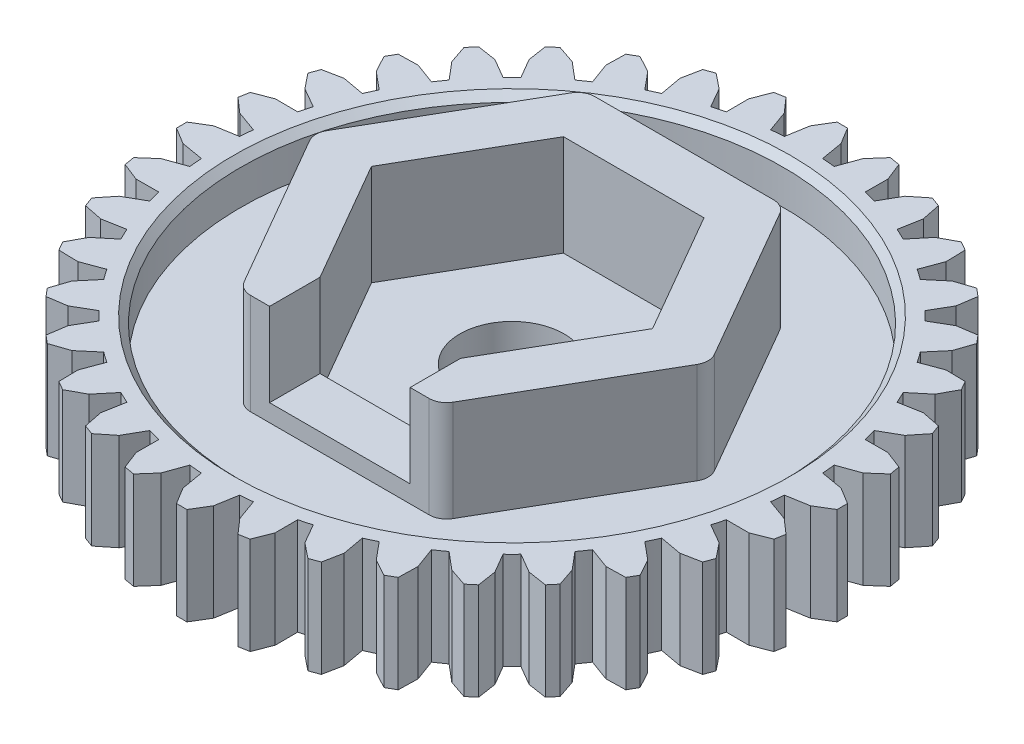
from build123d import *

# Parameters (mm, degrees)
SKETCH2_R           = 8.4
BOSS_EXTRUDE1_DEPTH = 2.8
SKETCH3_R           = 7.8
CUT_EXTRUDE1_DEPTH  = 1.2
CHAMFER1_SIZE       = 0.2
BOSS_EXTRUDE2_START = -1.6
BOSS_EXTRUDE2_DEPTH = 4.5
SKETCH5_W           = 4.041451884
SKETCH5_H           = 1.45
BOSS_EXTRUDE3_DEPTH = 0.5
SKETCH6_R           = 1.5
CUT_EXTRUDE2_DEPTH  = 1.6
BOSS_EXTRUDE4_DEPTH = 2.8
CIRPATTERN1_COUNT   = 36
FILLET1_R           = 0.5
SKETCH11_R          = 8
SKETCH11_R_2        = 7.8
BOSS_EXTRUDE5_DEPTH = 0.1
FILLET2_R           = 0.05


with BuildPart() as part:
    # Sketch2 → Boss-Extrude1 (new body)
    with BuildSketch(Plane(origin=(0, 0, 0), x_dir=(1, 0, 0), z_dir=(0, 1, 0))):
        with Locations(Location((0, 0, 0), (0, 0, 270))):
            Circle(SKETCH2_R)
    extrude(amount=BOSS_EXTRUDE1_DEPTH)

    # Sketch3 → Cut-Extrude1 (cut)
    with BuildSketch(Plane(origin=(0, 2.8, 0), x_dir=(1, 0, 0), z_dir=(0, 1, 0))):
        with Locations(Location((0, 0, 0), (0, 0, 270))):
            Circle(SKETCH3_R)
    extrude(amount=-CUT_EXTRUDE1_DEPTH, mode=Mode.SUBTRACT)

    # Chamfer1
    chamfer1_edges = [part.edges().sort_by_distance(p)[0] for p in [
        (0, 2.8, -7.8),
    ]]
    chamfer(chamfer1_edges, length=CHAMFER1_SIZE)

    # Sketch4 → Boss-Extrude2 (add)
    with BuildSketch(Plane(origin=(0, 1.6, 0), x_dir=(1, 0, 0), z_dir=(0, 1, 0)).offset(BOSS_EXTRUDE2_START)):
        Polygon((-2.020725942, -3.5), (-4.041451884, 0), (-2.020725942, 3.5), (2.020725942, 3.5), (4.041451884, 0), (2.020725942, -3.5), (2.020725942, -4.95), (2.857883832, -4.95), (5.715767665, 0), (2.857883832, 4.95), (-2.857883832, 4.95), (-5.715767665, 0), (-2.857883832, -4.95), (-2.020725942, -4.95), align=None)
    extrude(amount=BOSS_EXTRUDE2_DEPTH)

    # Sketch5 → Boss-Extrude3 (add)
    with BuildSketch(Plane(origin=(0, 1.6, 0), x_dir=(1, 0, 0), z_dir=(0, 1, 0))):
        with Locations((0, -4.225)):
            Rectangle(SKETCH5_W, SKETCH5_H)
    extrude(amount=BOSS_EXTRUDE3_DEPTH)

    # Sketch6 → Cut-Extrude2 (cut)
    with BuildSketch(Plane(origin=(0, 1.6, 0), x_dir=(1, 0, 0), z_dir=(0, 1, 0))):
        with Locations(Location((0, 0, 0), (0, 0, 270))):
            Circle(SKETCH6_R)
    extrude(amount=-CUT_EXTRUDE2_DEPTH, mode=Mode.SUBTRACT)

    # Sketch8 → Boss-Extrude4 (add)
    with BuildSketch(Plane.XZ):
        Polygon((-0.15, 9.498815716), (0.15, 9.498815716), (0.44, 9.021974708), (0.55, 8.381974708), (-0.55, 8.381974708), (-0.44, 9.021974708), align=None)
    boss_extrude4 = extrude(amount=-BOSS_EXTRUDE4_DEPTH)

    # CirPattern1: Boss-Extrude4 ×36 about axis
    cirpattern1_axis = Axis((0, 0, 0), (0, 1, 0))
    for i in range(1, CIRPATTERN1_COUNT):
        add(boss_extrude4.rotate(cirpattern1_axis, i * 360 / CIRPATTERN1_COUNT))

    # Fillet1
    fillet1_edges = [part.edges().sort_by_distance(p)[0] for p in [
        (2.857883832, 3.05, 4.95),
        (5.715767665, 3.05, 0),
        (2.857883832, 3.05, -4.95),
        (-2.857883832, 3.05, -4.95),
        (-5.715767665, 3.05, 0),
        (-2.857883832, 3.05, 4.95),
    ]]
    fillet(fillet1_edges, radius=FILLET1_R)

    # Sketch11 → Boss-Extrude5 (add)
    with BuildSketch(Plane.XZ):
        with Locations(Location((0, 0, 0), (0, 0, 90))):
            Circle(SKETCH11_R)
        with Locations(Location((0, 0, 0), (0, 0, 90))):
            Circle(SKETCH11_R_2, mode=Mode.SUBTRACT)
    extrude(amount=BOSS_EXTRUDE5_DEPTH)

    # Fillet2
    fillet2_edges = [part.edges().sort_by_distance(p)[0] for p in [
        (0, -0.1, -8),
        (0, -0.1, -7.8),
    ]]
    fillet(fillet2_edges, radius=FILLET2_R)


solid = part.part
